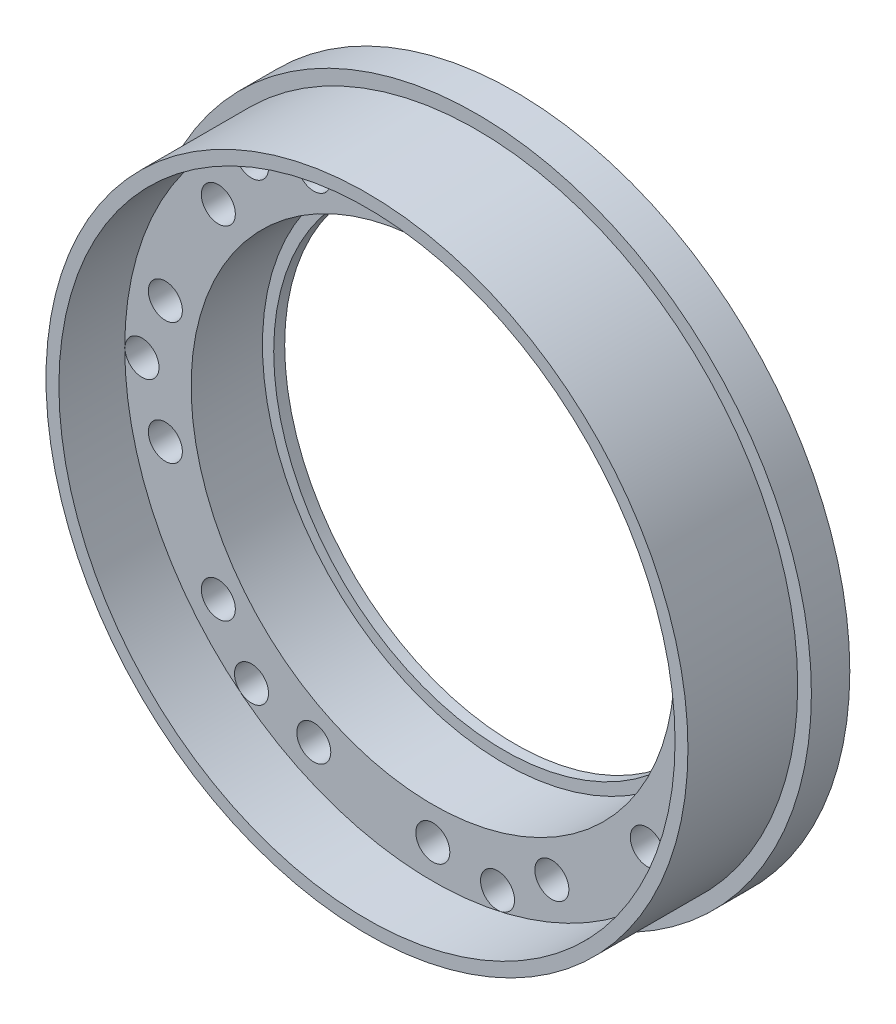
from build123d import *

# Parameters (mm, degrees)
SKETCH1_R           = 30.5
SKETCH1_R_2         = 22.025
BOSS_EXTRUDE1_DEPTH = 3.5
LAPVSROTOR_START    = 3.5
SKETCH1_8_R         = 29.25
SKETCH1_8_R_2       = 22.025
LAPVSROTOR_DEPTH    = 10
CUT_EXTRUDE1_START  = 13.5
SKETCH1_9_R         = 1.55
CUT_EXTRUDE1_DEPTH  = 10
SKETCH2_R           = 22.05
SKETCH2_R_2         = 21
BOSS_EXTRUDE3_DEPTH = 1
SKETCH3_R           = 1.55
CUT_EXTRUDE2_DEPTH  = 46.196791922
CUT_EXTRUDE3_START  = 7.5
SKETCH4_R           = 28.075
SKETCH4_R_2         = 21
CUT_EXTRUDE3_DEPTH  = 6
SKETCH5_R           = 3
CUT_EXTRUDE4_DEPTH  = 2.5
CIRPATTERN1_COUNT   = 7


with BuildPart() as part:
    # Sketch1 → Boss-Extrude1 (new body)
    with BuildSketch(Plane.XY):
        Circle(SKETCH1_R)
        Circle(SKETCH1_R_2, mode=Mode.SUBTRACT)
    extrude(amount=BOSS_EXTRUDE1_DEPTH)

    # Sketch1<8> → lapvsrotor (add)
    with BuildSketch(Plane.XY.offset(LAPVSROTOR_START)):
        Circle(SKETCH1_8_R)
        Circle(SKETCH1_8_R_2, mode=Mode.SUBTRACT)
    extrude(amount=LAPVSROTOR_DEPTH)

    # Sketch1<9> → Cut-Extrude1 (cut)
    with BuildSketch(Plane.XY.offset(CUT_EXTRUDE1_START)):
        with Locations((0, 25)):
            Circle(SKETCH1_9_R)
        with Locations((10.847093478, 22.524221698)):
            Circle(SKETCH1_9_R)
        with Locations((19.545787062, 15.587245046)):
            Circle(SKETCH1_9_R)
        with Locations((24.373197805, 5.563023349)):
            Circle(SKETCH1_9_R)
        with Locations((24.373197805, -5.563023349)):
            Circle(SKETCH1_9_R)
        with Locations((19.545787062, -15.587245046)):
            Circle(SKETCH1_9_R)
        with Locations((10.847093478, -22.524221698)):
            Circle(SKETCH1_9_R)
        with Locations((0, -25)):
            Circle(SKETCH1_9_R)
        with Locations((-10.847093478, -22.524221698)):
            Circle(SKETCH1_9_R)
        with Locations((-19.545787062, -15.587245046)):
            Circle(SKETCH1_9_R)
        with Locations((-24.373197805, -5.563023349)):
            Circle(SKETCH1_9_R)
        with Locations((-24.373197805, 5.563023349)):
            Circle(SKETCH1_9_R)
        with Locations((-19.545787062, 15.587245046)):
            Circle(SKETCH1_9_R)
        with Locations((-10.847093478, 22.524221698)):
            Circle(SKETCH1_9_R)
    extrude(amount=-CUT_EXTRUDE1_DEPTH, mode=Mode.SUBTRACT)

    # Sketch2 → Boss-Extrude3 (add)
    with BuildSketch(Plane.XY):
        Circle(SKETCH2_R)
        Circle(SKETCH2_R_2, mode=Mode.SUBTRACT)
    extrude(amount=BOSS_EXTRUDE3_DEPTH)

    # Sketch3 → Cut-Extrude2 (cut, through all)
    with BuildSketch(Plane.XY):
        with Locations((5.89680475, 25.835589673)):
            Circle(SKETCH3_R)
        with Locations((23.875674999, 11.497919087)):
            Circle(SKETCH3_R)
        with Locations((23.875674999, -11.497919087)):
            Circle(SKETCH3_R)
        with Locations((5.89680475, -25.835589673)):
            Circle(SKETCH3_R)
        with Locations((-16.522479749, -20.718534285)):
            Circle(SKETCH3_R)
        with Locations((-26.5, 0)):
            Circle(SKETCH3_R)
        with Locations((-16.522479749, 20.718534285)):
            Circle(SKETCH3_R)
    extrude(amount=CUT_EXTRUDE2_DEPTH, mode=Mode.SUBTRACT)

    # Sketch4 → Cut-Extrude3 (cut)
    with BuildSketch(Plane.XY.offset(CUT_EXTRUDE3_START)):
        Circle(SKETCH4_R)
        Circle(SKETCH4_R_2, mode=Mode.SUBTRACT)
    extrude(amount=CUT_EXTRUDE3_DEPTH, mode=Mode.SUBTRACT)

    # Sketch5 → Cut-Extrude4 (cut)
    with BuildSketch(Plane.XY):
        with Locations((5.89680475, 25.835589673)):
            Circle(SKETCH5_R)
    cut_extrude4 = extrude(amount=CUT_EXTRUDE4_DEPTH, mode=Mode.SUBTRACT)

    # CirPattern1: Cut-Extrude4 ×7 about axis
    cirpattern1_axis = Axis((0, 0, 0), (0, 0, 1))
    for i in range(1, CIRPATTERN1_COUNT):
        add(cut_extrude4.rotate(cirpattern1_axis, i * 360 / CIRPATTERN1_COUNT), mode=Mode.SUBTRACT)


solid = part.part
